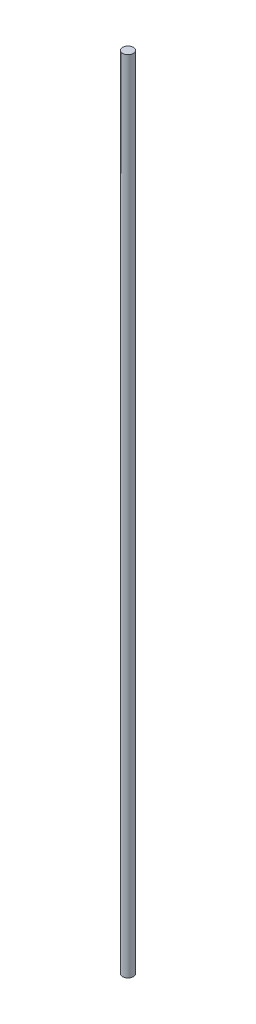
from build123d import *

# Parameters (mm, degrees)
SKETCH_1_R      = 3
EXTRUDE_1_DEPTH = 450


with BuildPart() as part:
    # 草图1 → 凸台-拉伸1 (new body)
    with BuildSketch(Plane(origin=(0, 0, 0), x_dir=(1, 0, 0), z_dir=(0, 1, 0))):
        with Locations(Location((0, 0, 0), (0, 0, 270))):
            Circle(SKETCH_1_R)
    extrude(amount=EXTRUDE_1_DEPTH)


solid = part.part
